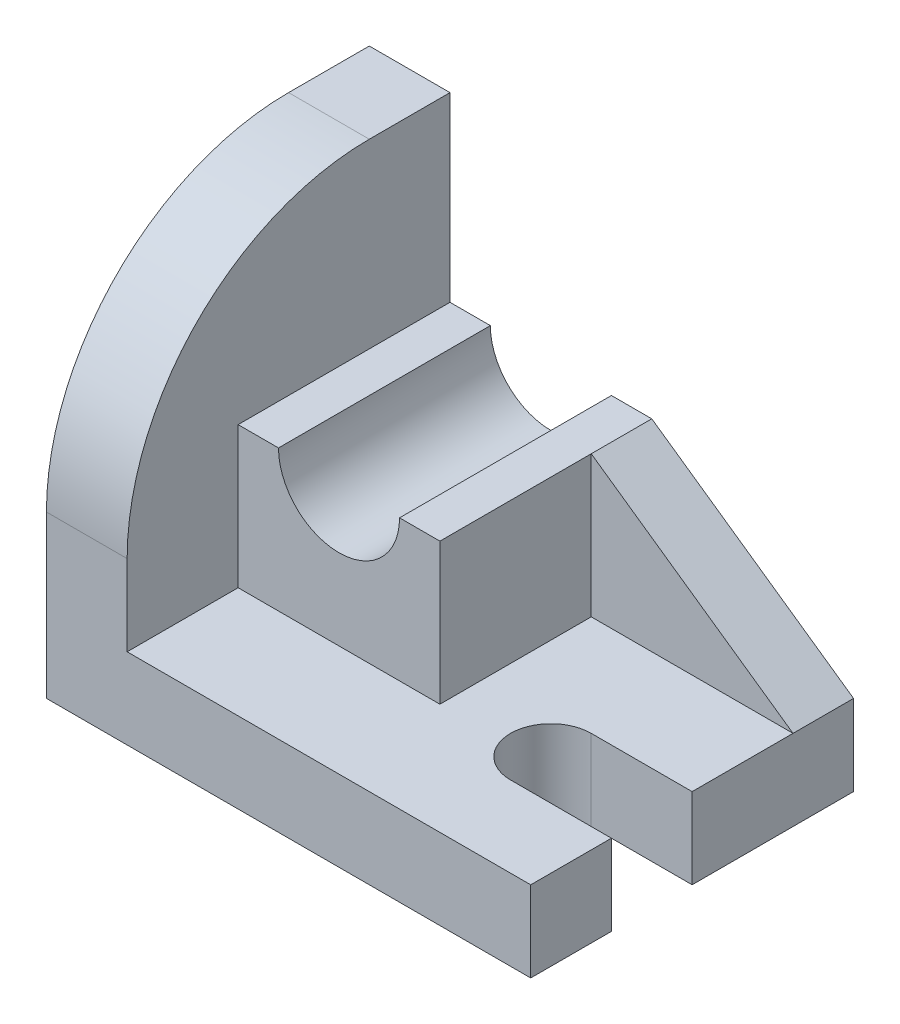
from build123d import *

# Parameters (mm, degrees)
SKETCH1_W           = 96
SKETCH1_H           = 64
BOSS_EXTRUDE1_DEPTH = 16
SKETCH2_W           = 64
SKETCH2_H           = 64
BOSS_EXTRUDE2_DEPTH = 16
FILLET2_R           = 48
SKETCH3_W           = 40
SKETCH3_H           = 42
BOSS_EXTRUDE3_DEPTH = 28
SKETCH4_R           = 12
CUT_EXTRUDE1_DEPTH  = 103.313244499
CUT_EXTRUDE2_DEPTH  = 87.162636914
BOSS_EXTRUDE5_DEPTH = 12


with BuildPart() as part:
    # Sketch1 → Boss-Extrude1 (new body)
    with BuildSketch(Plane(origin=(0, 0, 0), x_dir=(1, 0, 0), z_dir=(0, 1, 0))):
        Rectangle(SKETCH1_W, SKETCH1_H)
    extrude(amount=BOSS_EXTRUDE1_DEPTH)

    # Sketch2 → Boss-Extrude2 (add)
    with BuildSketch(Plane.ZY.offset(48)):
        with Locations((0, 48)):
            Rectangle(SKETCH2_W, SKETCH2_H)
    extrude(amount=-BOSS_EXTRUDE2_DEPTH)

    # Fillet2
    fillet2_edges = [part.edges().sort_by_distance(p)[0] for p in [
        (-40, 80, 32),
    ]]
    fillet(fillet2_edges, radius=FILLET2_R)

    # Sketch3 → Boss-Extrude3 (add)
    with BuildSketch(Plane(origin=(0, 16, 0), x_dir=(1, 0, 0), z_dir=(0, 1, 0))):
        with Locations((-12, 11)):
            Rectangle(SKETCH3_W, SKETCH3_H)
    extrude(amount=BOSS_EXTRUDE3_DEPTH)

    # Sketch4 → Cut-Extrude1 (cut, through all)
    with BuildSketch(Plane.XY.offset(10)):
        with Locations((-12, 44)):
            Circle(SKETCH4_R)
    extrude(amount=-CUT_EXTRUDE1_DEPTH, mode=Mode.SUBTRACT)

    # Sketch6 → Cut-Extrude2 (cut, through all)
    with BuildSketch(Plane(origin=(0, 16, 0), x_dir=(1, 0, 0), z_dir=(0, 1, 0))):
        with BuildLine():
            Line((48, -16), (28, -16))
            ThreePointArc((28, -16), (20, -8), (28, 0))
            Line((28, 0), (48, 0))
            ThreePointArc((48, 0), (56, -8), (48, -16))
        make_face()
    extrude(amount=-CUT_EXTRUDE2_DEPTH, mode=Mode.SUBTRACT)

    # Sketch7 → Boss-Extrude5 (add)
    with BuildSketch(Plane(origin=(0, 0, -32), x_dir=(-1, 0, 0), z_dir=(0, 0, -1))):
        Polygon((-8, 44), (-48, 16), (-8, 16), align=None)
    extrude(amount=-BOSS_EXTRUDE5_DEPTH)


solid = part.part
